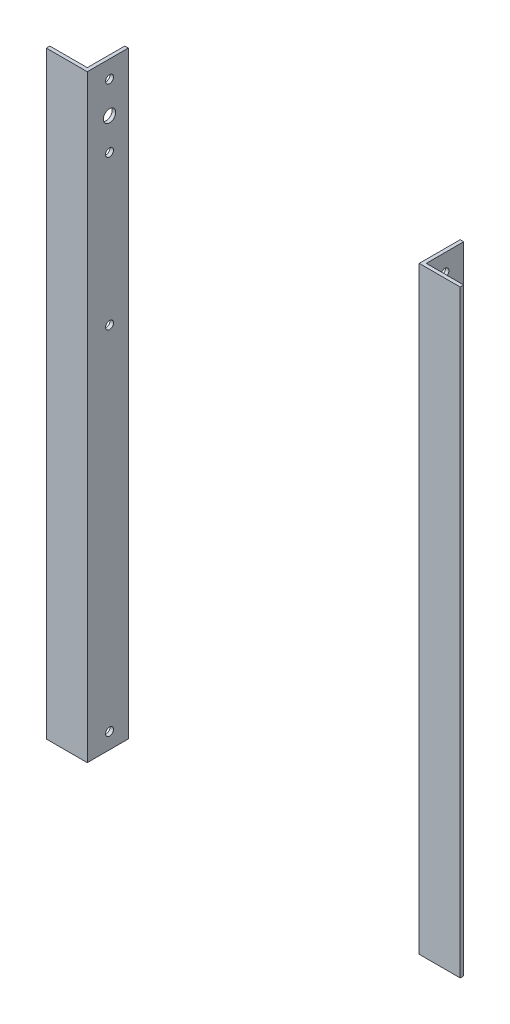
from build123d import *

# Parameters (mm, degrees)
BOSS_EXTRUDE1_DEPTH   = 340
BOSS_EXTRUDE1_2_DEPTH = 340
SKETCH2_R             = 2.25
CUT_EXTRUDE1_DEPTH    = 215
SKETCH3_R             = 2.25
CUT_EXTRUDE2_DEPTH    = 215
SKETCH4_R             = 2.25
SKETCH4_R_2           = 3.5
CUT_EXTRUDE3_DEPTH    = 199


with BuildPart() as part:
    # Sketch1 → Boss-Extrude1 (new body)
    with BuildSketch(Plane(origin=(0, 0, 0), x_dir=(1, 0, 0), z_dir=(0, 1, 0))):
        Polygon((188.6, 0), (188.6, 23.3), (190.6, 23.3), (190.6, 2), (211.9, 2), (211.9, 0), align=None)
    extrude(amount=BOSS_EXTRUDE1_DEPTH)


with BuildPart() as body_2:
    # Sketch1 → Boss-Extrude1 2 (new body)
    with BuildSketch(Plane(origin=(0, 0, 0), x_dir=(1, 0, 0), z_dir=(0, 1, 0))):
        Polygon((-23.3, 2), (-23.3, 0), (0, 0), (0, 23.3), (-2, 23.3), (-2, 2), align=None)
    extrude(amount=BOSS_EXTRUDE1_2_DEPTH)


with BuildPart() as cut_extrude1_tool:
    # Sketch2 → Cut-Extrude1 (new body)
    with BuildSketch(Plane(origin=(190.6, 0, 0), x_dir=(0, 0, -1), z_dir=(1, 0, 0))):
        with Locations((12.65, 9)):
            Circle(SKETCH2_R)
    extrude(amount=-CUT_EXTRUDE1_DEPTH)


with BuildPart() as part_1:
    add(part.part)

    # Cut-Extrude1: cut by cut_extrude1_tool
    add(cut_extrude1_tool.part, mode=Mode.SUBTRACT)


with BuildPart() as body_2_1:
    add(body_2.part)

    # Cut-Extrude1: cut by cut_extrude1_tool
    add(cut_extrude1_tool.part, mode=Mode.SUBTRACT)


with BuildPart() as cut_extrude2_tool:
    # Sketch3 → Cut-Extrude2 (new body)
    with BuildSketch(Plane(origin=(190.6, 0, 0), x_dir=(0, 0, -1), z_dir=(1, 0, 0))):
        with Locations((12.65, 209)):
            Circle(SKETCH3_R)
    extrude(amount=-CUT_EXTRUDE2_DEPTH)


with BuildPart() as part_2:
    add(part_1.part)

    # Cut-Extrude2: cut by cut_extrude2_tool
    add(cut_extrude2_tool.part, mode=Mode.SUBTRACT)


with BuildPart() as body_2_2:
    add(body_2_1.part)

    # Cut-Extrude2: cut by cut_extrude2_tool
    add(cut_extrude2_tool.part, mode=Mode.SUBTRACT)


with BuildPart() as cut_extrude3_tool:
    # Sketch4 → Cut-Extrude3 (new body)
    with BuildSketch(Plane.ZY.offset(2)):
        with Locations((-12.65, 330)):
            Circle(SKETCH4_R)
        with Locations((-12.65, 294)):
            Circle(SKETCH4_R)
        with Locations((-12.65, 312)):
            Circle(SKETCH4_R_2)
    extrude(amount=-CUT_EXTRUDE3_DEPTH)


with BuildPart() as part_3:
    add(part_2.part)

    # Cut-Extrude3: cut by cut_extrude3_tool
    add(cut_extrude3_tool.part, mode=Mode.SUBTRACT)


with BuildPart() as body_2_3:
    add(body_2_2.part)

    # Cut-Extrude3: cut by cut_extrude3_tool
    add(cut_extrude3_tool.part, mode=Mode.SUBTRACT)


solid = Compound([part_3.part, body_2_3.part])
